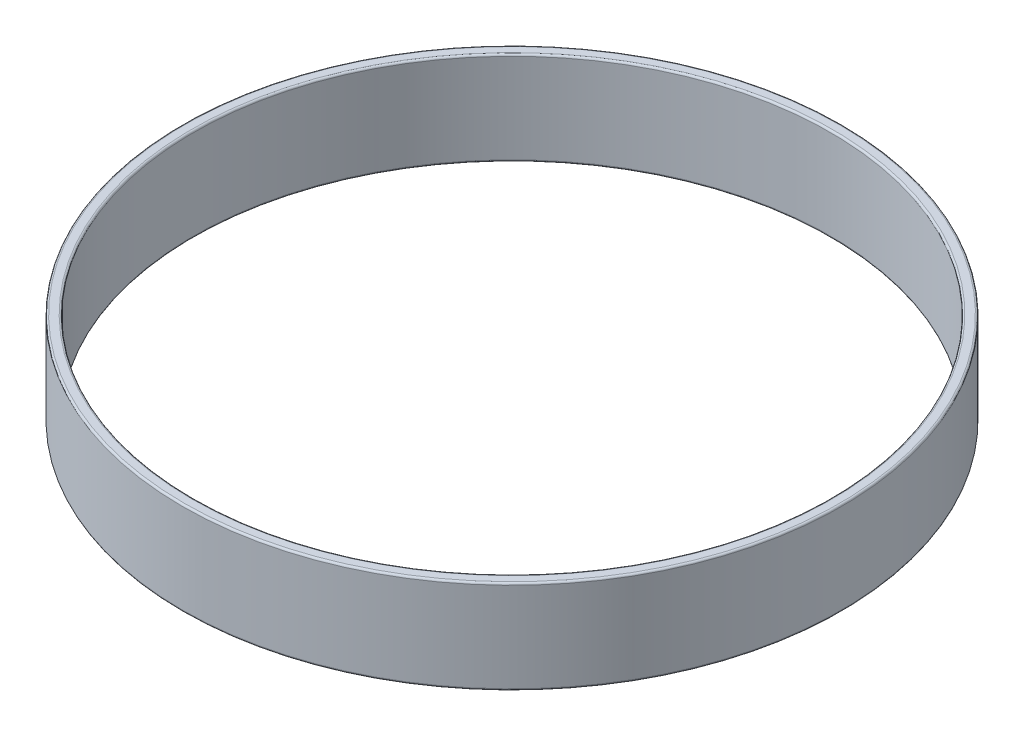
from build123d import *

# Parameters (mm, degrees)
SKETCH1_R           = 88.25
SKETCH1_R_2         = 85.25
BOSS_EXTRUDE1_DEPTH = 12.5
FILLET1_R           = 0.5


with BuildPart() as part:
    # Sketch1 → Boss-Extrude1 (new, symmetric)
    with BuildSketch(Plane(origin=(0, 0, 0), x_dir=(1, 0, 0), z_dir=(0, 1, 0))):
        with Locations(Location((0, 0, 0), (0, 0, 270))):
            Circle(SKETCH1_R)
        with Locations(Location((0, 0, 0), (0, 0, 270))):
            Circle(SKETCH1_R_2, mode=Mode.SUBTRACT)
    extrude(amount=BOSS_EXTRUDE1_DEPTH, both=True)

    # Fillet1
    fillet1_edges = [part.edges().sort_by_distance(p)[0] for p in [
        (0, -12.5, -88.25),
        (0, 12.5, -88.25),
        (0, -12.5, -85.25),
        (0, 12.5, -85.25),
    ]]
    fillet(fillet1_edges, radius=FILLET1_R)


solid = part.part
